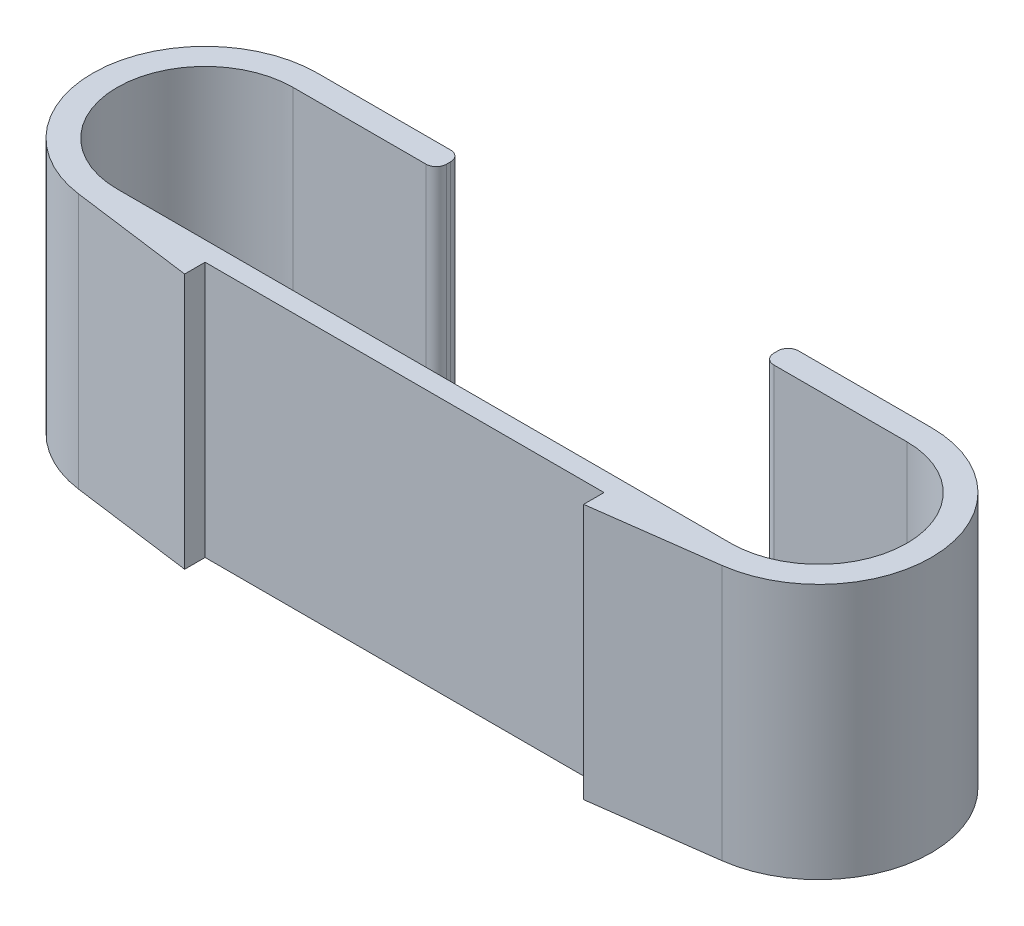
from build123d import *

# Parameters (mm, degrees)
EXTRUDE_THIN1_DEPTH = 25
BOSS_EXTRUDE1_DEPTH = 1.2
BOSS_EXTRUDE2_DEPTH = 25
FILLET1_R           = 1
FILLET2_R           = 5
SKETCH6_W           = 39
SKETCH6_H           = 25
CUT_EXTRUDE1_DEPTH  = 0.5


with BuildPart() as part:
    # Sketch1 → Extrude-Thin1 (new body)
    with BuildSketch(Plane(origin=(0, 0, 0), x_dir=(1, 0, 0), z_dir=(0, 1, 0))):
        with BuildLine():
            Line((0, 0), (-30, 0))
            ThreePointArc((-30, 0), (-41, 11), (-30, 22))
            Line((-30, 22), (-16, 22))
            Line((-16, 22), (-16, 19.6))
            Line((-16, 19.6), (-30, 19.6))
            ThreePointArc((-30, 19.6), (-38.6, 11), (-30, 2.4))
            Line((-30, 2.4), (0, 2.4))
            Line((0, 2.4), (0, 0))
        make_face()
    extrude_thin1 = extrude(amount=EXTRUDE_THIN1_DEPTH)

    # Sketch2 → Boss-Extrude1 (add)
    with BuildSketch(Plane(origin=(0, 0, 0), x_dir=(1, 0, 0), z_dir=(0, 1, 0))):
        with BuildLine():
            Line((-30, 22), (-30, 0))
            ThreePointArc((-30, 0), (-41, 11), (-30, 22))
        make_face()
    boss_extrude1 = extrude(amount=BOSS_EXTRUDE1_DEPTH)

    # Sketch4 → Boss-Extrude2 (add)
    with BuildSketch(Plane(origin=(0, 0, 0), x_dir=(1, 0, 0), z_dir=(0, 1, 0))):
        Polygon((-19.5, 0), (-19.5, -1.5), (-31.456178185, 0.096810325), align=None)
    boss_extrude2 = extrude(amount=BOSS_EXTRUDE2_DEPTH)

    # Mirror1: Extrude-Thin1, Boss-Extrude1, Boss-Extrude2 across plane
    add(extrude_thin1.mirror(Plane(origin=(0, 25, -2.4), x_dir=(0, 0, 1), z_dir=(1, 0, 0))))
    add(boss_extrude1.mirror(Plane(origin=(0, 25, -2.4), x_dir=(0, 0, 1), z_dir=(1, 0, 0))))
    add(boss_extrude2.mirror(Plane(origin=(0, 25, -2.4), x_dir=(0, 0, 1), z_dir=(1, 0, 0))))

    # Fillet1
    fillet1_edges = [part.edges().sort_by_distance(p)[0] for p in [
        (-16, 12.5, -22),
        (-16, 12.5, -19.6),
        (16, 12.5, -19.6),
        (16, 12.5, -22),
    ]]
    fillet(fillet1_edges, radius=FILLET1_R)

    # Fillet2
    fillet2_edges = [part.edges().sort_by_distance(p)[0] for p in [
        (-30, 0.6, -19.6),
        (-30, 0.6, -2.4),
        (30, 0.6, -19.6),
        (30, 0.6, -2.4),
    ]]
    fillet(fillet2_edges, radius=FILLET2_R)

    # Sketch6 → Cut-Extrude1 (cut)
    with BuildSketch(Plane.XY):
        with Locations((0, 12.5)):
            Rectangle(SKETCH6_W, SKETCH6_H)
    extrude(amount=-CUT_EXTRUDE1_DEPTH, mode=Mode.SUBTRACT)


solid = part.part
